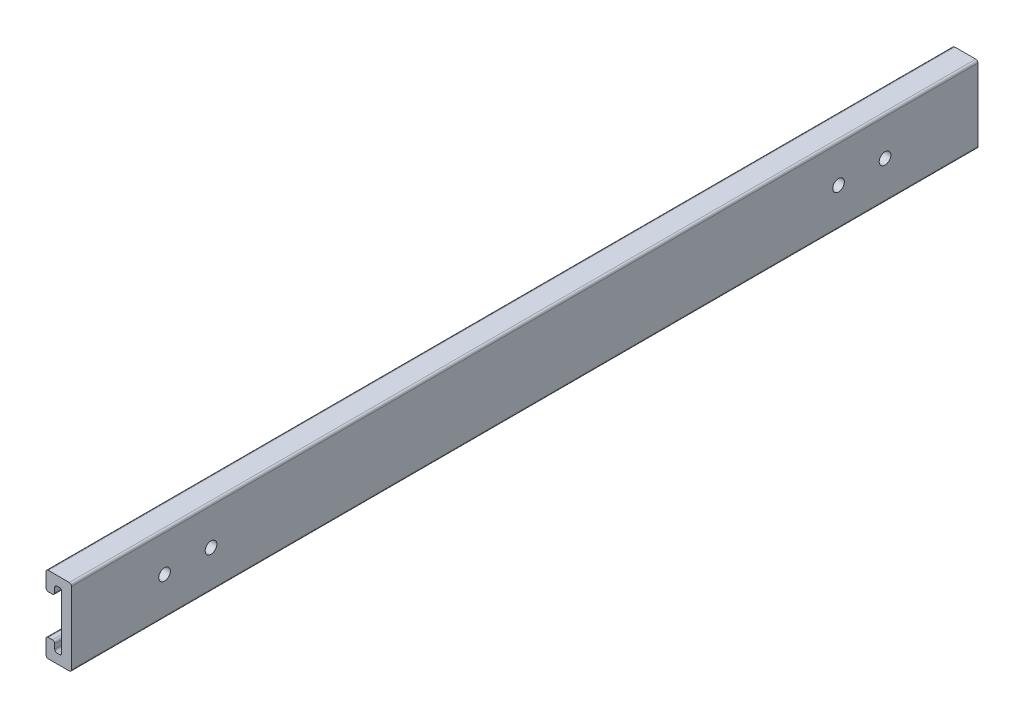
from build123d import *

# Parameters (mm, degrees)
BOSS_EXTRUDE1_DEPTH = 195
CUT_EXTRUDE1_REACH  = 197.813
SKETCH2_R           = 2.5


with BuildPart() as part:
    # Sketch1 → Boss-Extrude1 (new, symmetric)
    with BuildSketch(Plane.XY):
        with BuildLine():
            Line((5.5, -15.5), (5.5, 15.5))
            ThreePointArc((5.5, 15.5), (5.207106781, 16.207106781), (4.5, 16.5))
            Line((4.5, 16.5), (-4.5, 16.5))
            ThreePointArc((-4.5, 16.5), (-5.207106781, 16.207106781), (-5.5, 15.5))
            Line((-5.5, 15.5), (-5.5, 9.5))
            ThreePointArc((-5.5, 9.5), (-5.207106781, 8.792893219), (-4.5, 8.5))
            Line((-4.5, 8.5), (-2.75, 8.5))
            ThreePointArc((-2.75, 8.5), (-2.042893219, 8.792893219), (-1.75, 9.5))
            Line((-1.75, 9.5), (-1.75, 11.5))
            ThreePointArc((-1.75, 11.5), (-1.457106781, 12.207106781), (-0.75, 12.5))
            Line((-0.75, 12.5), (0.25, 12.5))
            ThreePointArc((0.25, 12.5), (0.957106781, 12.207106781), (1.25, 11.5))
            Line((1.25, 11.5), (1.25, -11.5))
            ThreePointArc((1.25, -11.5), (0.957106781, -12.207106781), (0.25, -12.5))
            Line((0.25, -12.5), (-0.75, -12.5))
            ThreePointArc((-0.75, -12.5), (-1.457106781, -12.207106781), (-1.75, -11.5))
            Line((-1.75, -11.5), (-1.75, -9.5))
            ThreePointArc((-1.75, -9.5), (-2.042893219, -8.792893219), (-2.75, -8.5))
            Line((-2.75, -8.5), (-4.5, -8.5))
            ThreePointArc((-4.5, -8.5), (-5.207106781, -8.792893219), (-5.5, -9.5))
            Line((-5.5, -9.5), (-5.5, -15.5))
            ThreePointArc((-5.5, -15.5), (-5.207106781, -16.207106781), (-4.5, -16.5))
            Line((-4.5, -16.5), (4.5, -16.5))
            ThreePointArc((4.5, -16.5), (5.207106781, -16.207106781), (5.5, -15.5))
        make_face()
    extrude(amount=BOSS_EXTRUDE1_DEPTH, both=True)

    # Sketch2 → Cut-Extrude1 (cut, up to next)
    with BuildSketch(Plane.ZY.offset(-1.25), mode=Mode.PRIVATE) as cut_extrude1_sk1:
        with Locations((155, 0)):
            Circle(SKETCH2_R)
    cut_extrude1_tool1 = extrude(cut_extrude1_sk1.sketch, amount=-CUT_EXTRUDE1_REACH, mode=Mode.PRIVATE) & part.part
    # Sketch2 → Cut-Extrude1 (cut, up to next)
    with BuildSketch(Plane.ZY.offset(-1.25), mode=Mode.PRIVATE) as cut_extrude1_sk2:
        with Locations((135, 0)):
            Circle(SKETCH2_R)
    cut_extrude1_tool2 = extrude(cut_extrude1_sk2.sketch, amount=-CUT_EXTRUDE1_REACH, mode=Mode.PRIVATE) & part.part
    # Sketch2 → Cut-Extrude1 (cut, up to next)
    with BuildSketch(Plane.ZY.offset(-1.25), mode=Mode.PRIVATE) as cut_extrude1_sk3:
        with Locations((-135, 0)):
            Circle(SKETCH2_R)
    cut_extrude1_tool3 = extrude(cut_extrude1_sk3.sketch, amount=-CUT_EXTRUDE1_REACH, mode=Mode.PRIVATE) & part.part
    # Sketch2 → Cut-Extrude1 (cut, up to next)
    with BuildSketch(Plane.ZY.offset(-1.25), mode=Mode.PRIVATE) as cut_extrude1_sk4:
        with Locations((-155, 0)):
            Circle(SKETCH2_R)
    cut_extrude1_tool4 = extrude(cut_extrude1_sk4.sketch, amount=-CUT_EXTRUDE1_REACH, mode=Mode.PRIVATE) & part.part
    add(cut_extrude1_tool1.solids().sort_by_distance((1.25, 0, 155))[0], mode=Mode.SUBTRACT)
    add(cut_extrude1_tool2.solids().sort_by_distance((1.25, 0, 135))[0], mode=Mode.SUBTRACT)
    add(cut_extrude1_tool3.solids().sort_by_distance((1.25, 0, -135))[0], mode=Mode.SUBTRACT)
    add(cut_extrude1_tool4.solids().sort_by_distance((1.25, 0, -155))[0], mode=Mode.SUBTRACT)


solid = part.part
